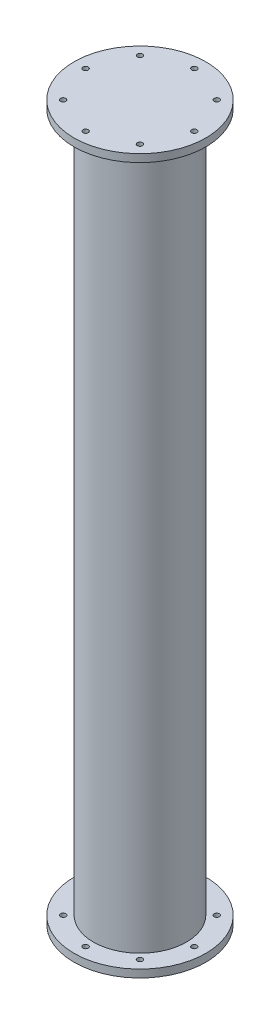
from build123d import *

# Parameters (mm, degrees)
CROQUIS1_R                   = 30
CROQUIS1_R_2                 = 25
SALIENTE_EXTRUIR1_DEPTH      = 225
CROQUIS2_R                   = 42.5
SALIENTE_EXTRUIR2_DEPTH      = 5
TALADRO_DE_MARGEN_PARA_M31_D = 3.4


with BuildPart() as part:
    # Croquis1 → Saliente-Extruir1 (new, symmetric)
    with BuildSketch(Plane(origin=(0, 0, 0), x_dir=(1, 0, 0), z_dir=(0, 1, 0))):
        with Locations(Location((0, 0, 0), (0, 0, 270))):
            Circle(CROQUIS1_R)
        with Locations(Location((0, 0, 0), (0, 0, 270))):
            Circle(CROQUIS1_R_2, mode=Mode.SUBTRACT)
    extrude(amount=SALIENTE_EXTRUIR1_DEPTH, both=True)

    # Croquis2 → Saliente-Extruir2 (add)
    with BuildSketch(Plane(origin=(0, 225, 0), x_dir=(1, 0, 0), z_dir=(0, 1, 0))):
        with Locations(Location((0, 0, 0), (0, 0, 270))):
            Circle(CROQUIS2_R)
    saliente_extruir2 = extrude(amount=SALIENTE_EXTRUIR2_DEPTH)

    # Taladro de margen para M31 (through all)
    with Locations(Plane(origin=(0, 225, 0), x_dir=(-1, 0, 0), z_dir=(0, -1, 0))):
        with Locations((0, -35), (-24.748737342, -24.748737342), (-35, 0), (-24.748737342, 24.748737342), (0, 35), (24.748737342, 24.748737342), (35, 0), (24.748737342, -24.748737342)):
            taladro_de_margen_para_m31 = Hole(TALADRO_DE_MARGEN_PARA_M31_D / 2)

    # Simetría1: Saliente-Extruir2, Taladro de margen para M31 across plane
    add(saliente_extruir2.mirror(Plane.ZX))
    add(taladro_de_margen_para_m31.mirror(Plane.ZX), mode=Mode.SUBTRACT)


solid = part.part
